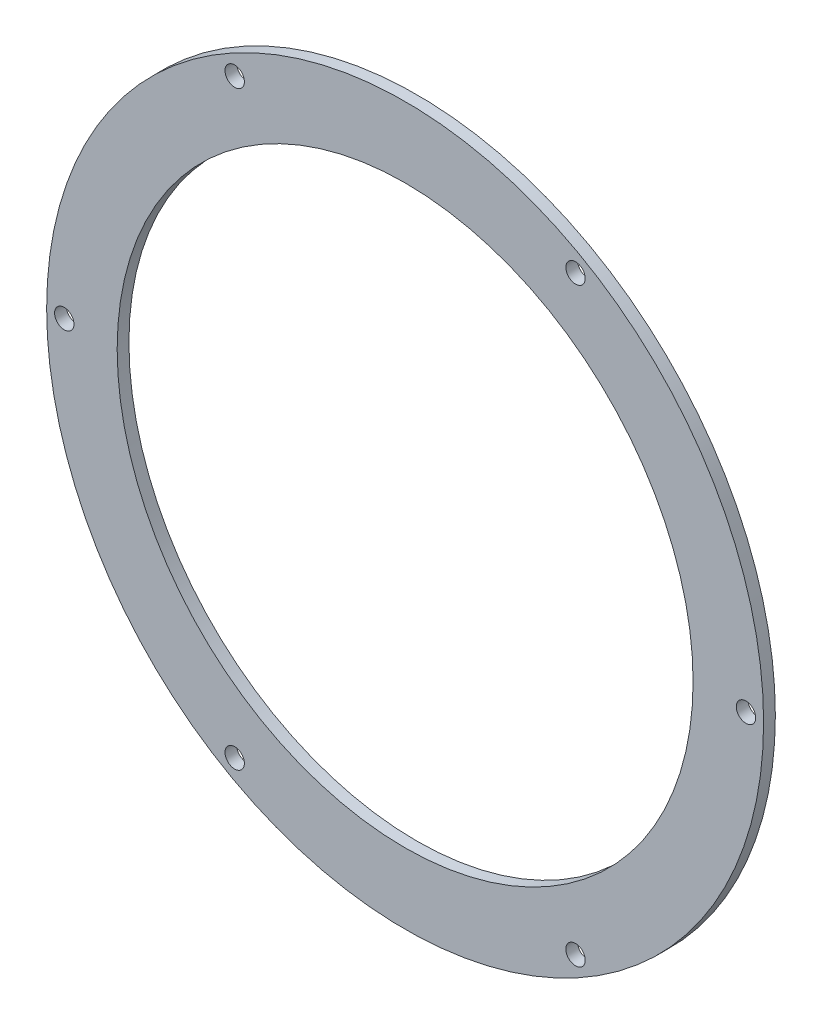
from build123d import *

# Parameters (mm, degrees)
STATOR_CLAMP_START  = 15
SKETCH_1_R          = 61
SKETCH_1_R_2        = 49
STATOR_CLAMP_DEPTH  = 2
SKETCH_2_R          = 1.65
THROUGH_HOLES_DEPTH = 100


with BuildPart() as part:
    # Эскиз1 → Stator_clamp (new body)
    with BuildSketch(Plane.XY.offset(STATOR_CLAMP_START)):
        Circle(SKETCH_1_R)
        Circle(SKETCH_1_R_2, mode=Mode.SUBTRACT)
    extrude(amount=STATOR_CLAMP_DEPTH)

    # Эскиз2 → Through_holes (cut, symmetric)
    with BuildSketch(Plane.XY):
        with Locations((58, 0)):
            Circle(SKETCH_2_R)
        with Locations((29, 50.229473419)):
            Circle(SKETCH_2_R)
        with Locations((-29, 50.229473419)):
            Circle(SKETCH_2_R)
        with Locations((-58, 0)):
            Circle(SKETCH_2_R)
        with Locations((-29, -50.229473419)):
            Circle(SKETCH_2_R)
        with Locations((29, -50.229473419)):
            Circle(SKETCH_2_R)
    extrude(amount=THROUGH_HOLES_DEPTH, both=True, mode=Mode.SUBTRACT)


solid = part.part
